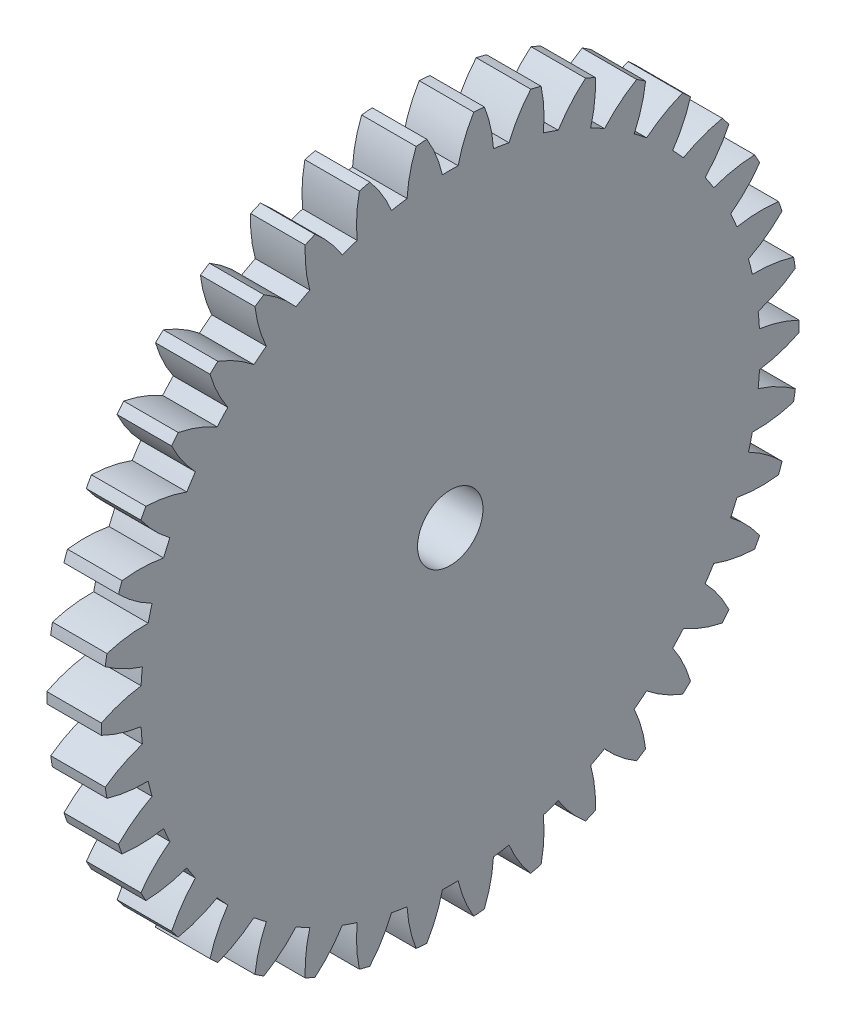
from build123d import *

# Parameters (mm, degrees)
BASPROSKE_W     = 2.5
BASPROSKE_H     = 16
TOOTHCUT_DEPTH  = 23.765104876
TEETHCUTS_COUNT = 38
TEETHCUTS_ANGLE = 350.526315789
BORSKE_R        = 1.5
BORE_DEPTH      = 50.0000508


with BuildPart() as part:
    # BasProSke → Base-Revolve (revolve)
    with BuildSketch(Plane(origin=(0, 0, 0), x_dir=(1, 0, 0), z_dir=(0, 1, 0)), mode=Mode.PRIVATE) as base_revolve_sk:
        with Locations((1.25, 8)):
            Rectangle(BASPROSKE_W, BASPROSKE_H)
    revolve(base_revolve_sk.sketch.rotate(Axis((-10, 0, 0), (1, 0, 0)), 180), axis=Axis((-10, 0, 0), (1, 0, 0)))

    # TooCutSke → ToothCut (cut, through all)
    with BuildSketch(Plane(origin=(0, 0, 0), x_dir=(0, 0, -1), z_dir=(1, 0, 0))):
        with BuildLine():
            ThreePointArc((0.360517573, 14.194422429), (0, 14.199), (-0.360517573, 14.194422429))
            ThreePointArc((-0.360517573, 14.194422429), (-0.654064323, 15.120599675), (-1.091392894, 15.988192728))
            ThreePointArc((-1.091392894, 15.988192728), (0, 16.0254), (1.091392894, 15.988192728))
            ThreePointArc((1.091392894, 15.988192728), (0.654064323, 15.120599675), (0.360517573, 14.194422429))
        make_face()
    toothcut = extrude(amount=TOOTHCUT_DEPTH, mode=Mode.SUBTRACT)

    # TeethCuts: ToothCut ×38 about axis
    teethcuts_axis = Axis((-10, 0, 0), (1, 0, 0))
    for i in range(1, TEETHCUTS_COUNT):
        add(toothcut.rotate(teethcuts_axis, i * TEETHCUTS_ANGLE / (TEETHCUTS_COUNT - 1)), mode=Mode.SUBTRACT)

    # BorSke → Bore (cut, symmetric)
    with BuildSketch(Plane(origin=(0, 0, 0), x_dir=(0, 0, -1), z_dir=(1, 0, 0))):
        with Locations(Location((0, 0, 0), (0, 0, 180))):
            Circle(BORSKE_R)
    extrude(amount=BORE_DEPTH, both=True, mode=Mode.SUBTRACT)


solid = part.part
